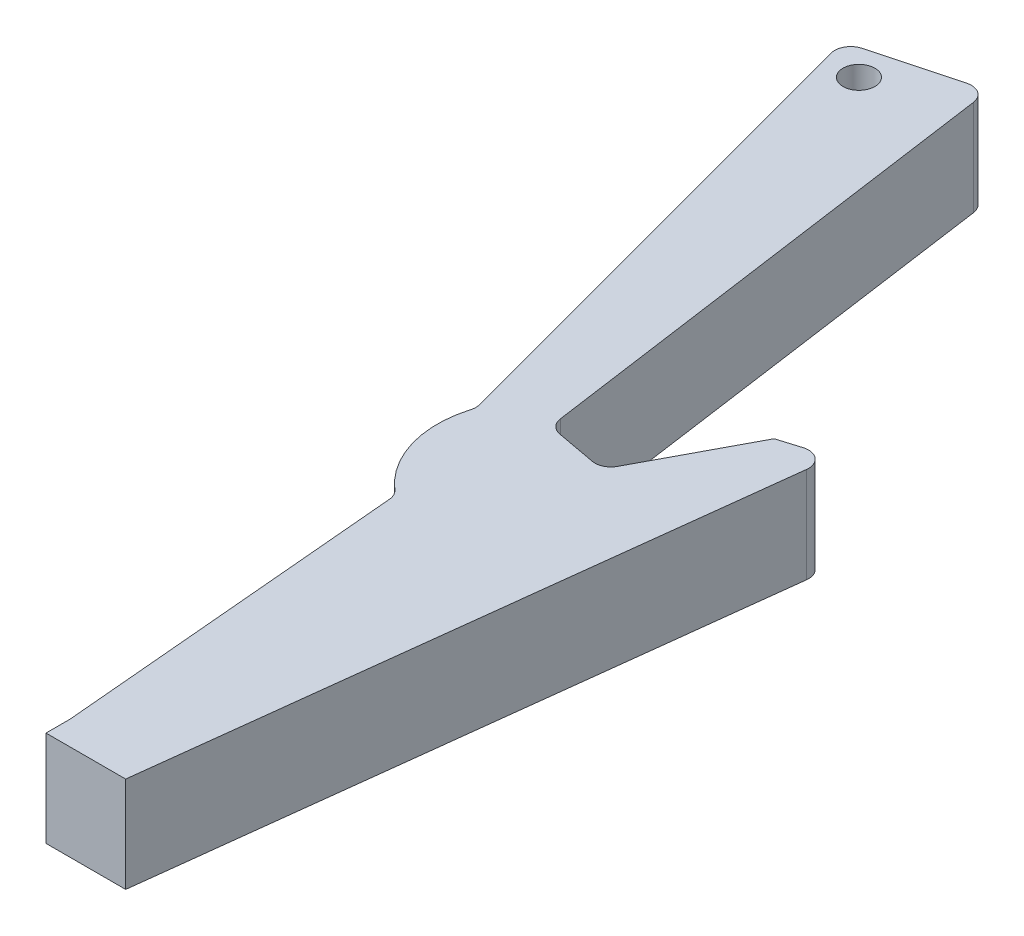
from build123d import *

# Parameters (mm, degrees)
BOSS_EXTRUDE1_DEPTH = 12
SKETCH2_R           = 2
CUT_EXTRUDE1_DEPTH  = 90.586836967
FILLET1_R           = 2


with BuildPart() as part:
    # Sketch1 → Boss-Extrude1 (new body)
    with BuildSketch(Plane(origin=(0, 0, 0), x_dir=(1, 0, 0), z_dir=(0, 1, 0))):
        with BuildLine():
            Line((-2.653491445, 44.576571896), (-17.14237884, 40.694286219))
            Line((-17.14237884, 40.694286219), (-0.319140908, -22.09089249))
            ThreePointArc((-0.319140908, -22.09089249), (-0.454624555, -30.053525084), (4.078758213, -36.601067701))
            Line((4.078758213, -36.601067701), (8.013795143, -81.428687361))
            Line((8.013795143, -81.428687361), (8.013795143, -84.428687361))
            Line((8.013795143, -84.428687361), (18.013795143, -84.428687361))
            Line((18.013795143, -84.428687361), (27.451741441, -4.98735574))
            Line((27.451741441, -4.98735574), (21.714594259, -6.743813031))
            Line((21.714594259, -6.743813031), (14.208533418, -20.873889133))
            Line((14.208533418, -20.873889133), (6.341121975, -19.423428104))
            Line((6.341121975, -19.423428104), (-2.653491445, 44.576571896))
        make_face()
    extrude(amount=BOSS_EXTRUDE1_DEPTH)

    # Sketch2 → Cut-Extrude1 (cut, through all)
    with BuildSketch(Plane(origin=(0, 12, 0), x_dir=(1, 0, 0), z_dir=(0, 1, 0))):
        with Locations(Location((-12.243399354, 37.865859094, 0), (0, 0, 270))):
            Circle(SKETCH2_R)
    extrude(amount=-CUT_EXTRUDE1_DEPTH, mode=Mode.SUBTRACT)

    # Fillet1
    fillet1_edges = [part.edges().sort_by_distance(p)[0] for p in [
        (6.341121975, 6, 19.423428104),
        (14.208533418, 6, 20.873889133),
        (27.451741441, 6, 4.98735574),
        (4.078758213, 6, 36.601067701),
        (-0.319140908, 6, 22.09089249),
        (-17.14237884, 6, -40.694286219),
        (-2.653491445, 6, -44.576571896),
    ]]
    fillet(fillet1_edges, radius=FILLET1_R)


solid = part.part
